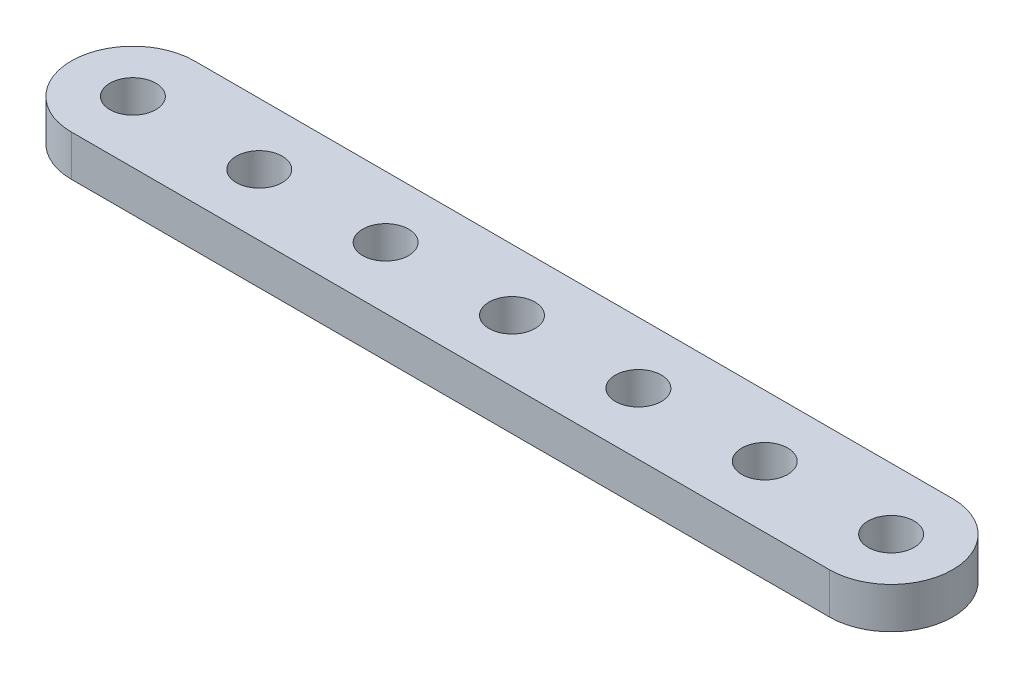
from build123d import *

# Parameters (mm, degrees)
SKETCH1_R           = 1.778
BOSS_EXTRUDE1_DEPTH = 6.35
SKETCH2_W           = 91.819515258
SKETCH2_H           = 20.708231101
CUT_EXTRUDE1_DEPTH  = 3.175


with BuildPart() as part:
    # Sketch1 → Boss-Extrude1 (new body)
    with BuildSketch(Plane.XZ):
        with BuildLine():
            Line((-29.337, -4.7625), (29.337, -4.7625))
            ThreePointArc((29.337, -4.7625), (34.0995, 0), (29.337, 4.7625))
            Line((29.337, 4.7625), (-29.337, 4.7625))
            ThreePointArc((-29.337, 4.7625), (-34.0995, 0), (-29.337, -4.7625))
        make_face()
        with Locations(Location((29.337, 0, 0), (0, 0, 90))):
            Circle(SKETCH1_R, mode=Mode.SUBTRACT)
        with Locations(Location((19.558, 0, 0), (0, 0, 90))):
            Circle(SKETCH1_R, mode=Mode.SUBTRACT)
        with Locations(Location((9.779, 0, 0), (0, 0, 90))):
            Circle(SKETCH1_R, mode=Mode.SUBTRACT)
        with Locations(Location((0, 0, 0), (0, 0, 90))):
            Circle(SKETCH1_R, mode=Mode.SUBTRACT)
        with Locations(Location((-9.779, 0, 0), (0, 0, 90))):
            Circle(SKETCH1_R, mode=Mode.SUBTRACT)
        with Locations(Location((-19.558, 0, 0), (0, 0, 90))):
            Circle(SKETCH1_R, mode=Mode.SUBTRACT)
        with Locations(Location((-29.337, 0, 0), (0, 0, 90))):
            Circle(SKETCH1_R, mode=Mode.SUBTRACT)
    extrude(amount=-BOSS_EXTRUDE1_DEPTH)

    # Sketch2 → Cut-Extrude1 (cut)
    with BuildSketch(Plane(origin=(0, 6.35, 0), x_dir=(1, 0, 0), z_dir=(0, 1, 0))):
        with Locations((-4.688656098, 0.586082012)):
            Rectangle(SKETCH2_W, SKETCH2_H)
    extrude(amount=-CUT_EXTRUDE1_DEPTH, mode=Mode.SUBTRACT)


solid = part.part
